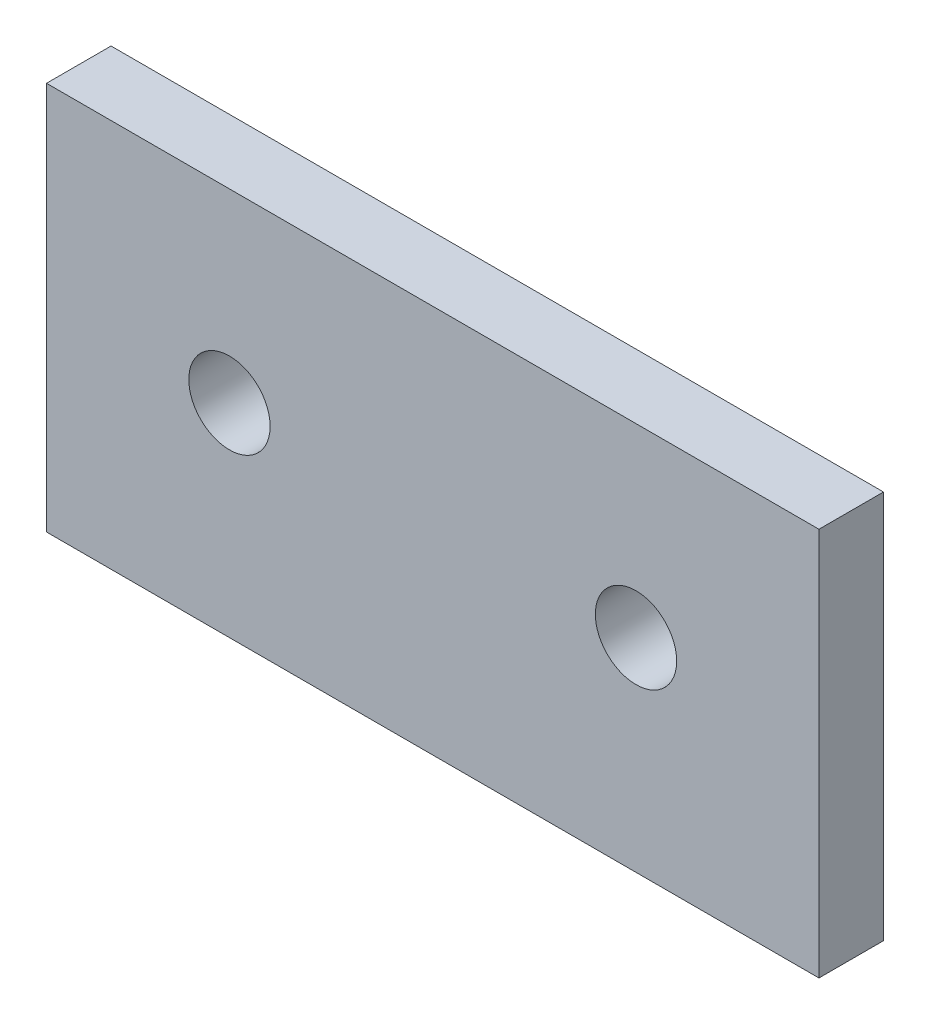
from build123d import *

# Parameters (mm, degrees)
SKETCH1_W             = 76
SKETCH1_H             = 38.238165328
SKETCH1_R             = 1.27
BOSS_EXTRUDE1_DEPTH   = 6.35
F_8_0MM_DOWEL_HOLE1_D = 8


with BuildPart() as part:
    # Sketch1 → Boss-Extrude1 (new body)
    with BuildSketch(Plane.XY):
        with Locations((38, 23.427645759)):
            Rectangle(SKETCH1_W, SKETCH1_H)
        with Locations((18, 24.308563095)):
            Circle(SKETCH1_R, mode=Mode.SUBTRACT)
        with Locations((58, 24.308563095)):
            Circle(SKETCH1_R, mode=Mode.SUBTRACT)
    extrude(amount=BOSS_EXTRUDE1_DEPTH)

    # Ø8.0mm Dowel Hole1 (through all)
    with Locations(Plane.XY.offset(6.35)):
        with Locations((18, 24.308563095), (58, 24.308563095)):
            Hole(F_8_0MM_DOWEL_HOLE1_D / 2)


solid = part.part
